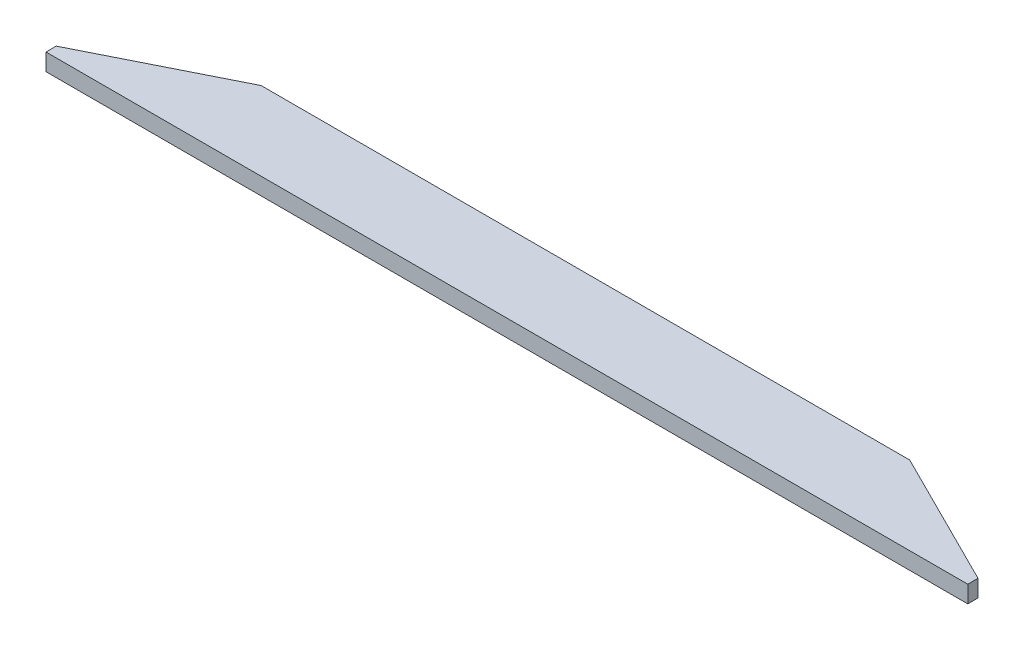
from build123d import *

# Parameters (mm, degrees)
ESQUISSE1_W             = 270
ESQUISSE1_H             = 23
BOSS_EXTRU_1_DEPTH      = 5
ENL_V_MAT_EXTRU_1_DEPTH = 10
ENL_V_MAT_EXTRU_2_DEPTH = 10


with BuildPart() as part:
    # Esquisse1 → Boss.-Extru.1 (new body)
    with BuildSketch(Plane(origin=(0, 0, 0), x_dir=(1, 0, 0), z_dir=(0, 1, 0))):
        Rectangle(ESQUISSE1_W, ESQUISSE1_H)
    extrude(amount=BOSS_EXTRU_1_DEPTH)

    # Esquisse3 → Enlèv. mat.-Extru.1 (cut)
    with BuildSketch(Plane(origin=(0, 5, 0), x_dir=(1, 0, 0), z_dir=(0, 1, 0))):
        Polygon((135, -8.5), (135, 11.5), (95, 11.5), align=None)
    extrude(amount=-ENL_V_MAT_EXTRU_1_DEPTH, mode=Mode.SUBTRACT)

    # Esquisse5 → Enlèv. mat.-Extru.2 (cut)
    with BuildSketch(Plane(origin=(0, 5, 0), x_dir=(1, 0, 0), z_dir=(0, 1, 0))):
        Polygon((-135, 11.5), (-95, 11.5), (-135, -8.5), align=None)
    extrude(amount=-ENL_V_MAT_EXTRU_2_DEPTH, mode=Mode.SUBTRACT)


solid = part.part
